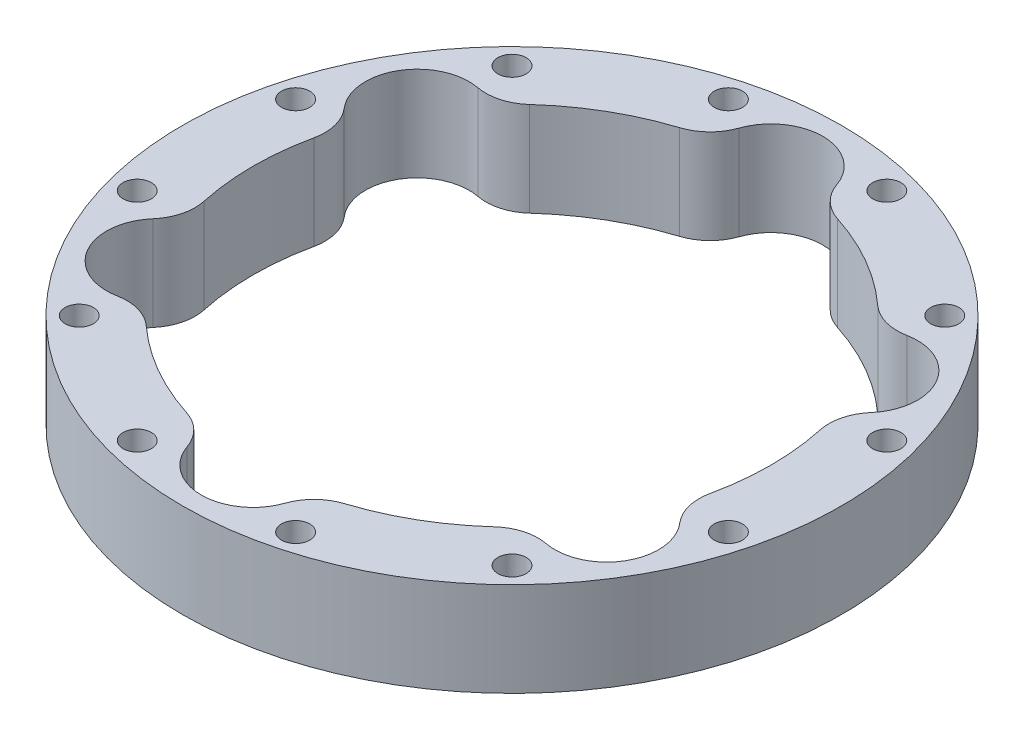
from build123d import *

# Parameters (mm, degrees)
SKETCH1_R           = 35
SKETCH1_R_2         = 1.5
BOSS_EXTRUDE1_DEPTH = 10
FILLET1_R           = 5


with BuildPart() as part:
    # Sketch1 → Boss-Extrude1 (new body)
    with BuildSketch(Plane(origin=(0, 0, 0), x_dir=(1, 0, 0), z_dir=(0, 1, 0))):
        with Locations(Location((0, 0, 0), (0, 0, 270))):
            Circle(SKETCH1_R)
        with Locations(Location((-22.980970389, -22.980970389, 0), (0, 0, 270))):
            Circle(SKETCH1_R_2, mode=Mode.SUBTRACT)
        with Locations(Location((-8.411618966, -31.392589354, 0), (0, 0, 270))):
            Circle(SKETCH1_R_2, mode=Mode.SUBTRACT)
        with Locations(Location((-31.392589354, -8.411618966, 0), (0, 0, 270))):
            Circle(SKETCH1_R_2, mode=Mode.SUBTRACT)
        with Locations(Location((8.411618966, -31.392589354, 0), (0, 0, 270))):
            Circle(SKETCH1_R_2, mode=Mode.SUBTRACT)
        with Locations(Location((22.980970389, -22.980970389, 0), (0, 0, 270))):
            Circle(SKETCH1_R_2, mode=Mode.SUBTRACT)
        with Locations(Location((31.392589354, -8.411618966, 0), (0, 0, 270))):
            Circle(SKETCH1_R_2, mode=Mode.SUBTRACT)
        with Locations(Location((-31.392589354, 8.411618966, 0), (0, 0, 270))):
            Circle(SKETCH1_R_2, mode=Mode.SUBTRACT)
        with Locations(Location((-22.980970389, 22.980970389, 0), (0, 0, 270))):
            Circle(SKETCH1_R_2, mode=Mode.SUBTRACT)
        with Locations(Location((-8.411618966, 31.392589354, 0), (0, 0, 270))):
            Circle(SKETCH1_R_2, mode=Mode.SUBTRACT)
        with BuildLine():
            ThreePointArc((26.075600084, 8.735735817), (27.141564088, 4.425550683), (27.5, 0))
            ThreePointArc((27.5, 0), (27.141564088, -4.425550683), (26.075600084, -8.735735817))
            ThreePointArc((26.075600084, -8.735735817), (28.435193064, -10.764992307), (29.315698604, -13.75))
            ThreePointArc((29.315698604, -13.75), (26.323794313, -18.644839723), (20.60316918, -18.214264183))
            ThreePointArc((20.60316918, -18.214264183), (13.75, -23.815698604), (5.472430904, -26.95))
            ThreePointArc((5.472430904, -26.95), (5.493103402, -27.224654737), (5.5, -27.5))
            ThreePointArc((5.5, -27.5), (-0.275345263, -32.993103402), (-5.472430904, -26.95))
            ThreePointArc((-5.472430904, -26.95), (-13.75, -23.815698604), (-20.60316918, -18.214264183))
            ThreePointArc((-20.60316918, -18.214264183), (-28.578838325, -16.5), (-26.075600084, -8.735735817))
            ThreePointArc((-26.075600084, -8.735735817), (-27.5, 0), (-26.075600084, 8.735735817))
            ThreePointArc((-26.075600084, 8.735735817), (-28.578838325, 16.5), (-20.60316918, 18.214264183))
            ThreePointArc((-20.60316918, 18.214264183), (-13.75, 23.815698604), (-5.472430904, 26.95))
            ThreePointArc((-5.472430904, 26.95), (-0.275345263, 32.993103402), (5.5, 27.5))
            ThreePointArc((5.5, 27.5), (5.493103402, 27.224654737), (5.472430904, 26.95))
            ThreePointArc((5.472430904, 26.95), (13.75, 23.815698604), (20.60316918, 18.214264183))
            ThreePointArc((20.60316918, 18.214264183), (26.323794313, 18.644839723), (29.315698604, 13.75))
            ThreePointArc((29.315698604, 13.75), (28.435193064, 10.764992307), (26.075600084, 8.735735817))
        make_face(mode=Mode.SUBTRACT)
        with Locations(Location((31.392589354, 8.411618966, 0), (0, 0, 270))):
            Circle(SKETCH1_R_2, mode=Mode.SUBTRACT)
        with Locations(Location((8.411618966, 31.392589354, 0), (0, 0, 270))):
            Circle(SKETCH1_R_2, mode=Mode.SUBTRACT)
        with Locations(Location((22.980970389, 22.980970389, 0), (0, 0, 270))):
            Circle(SKETCH1_R_2, mode=Mode.SUBTRACT)
    extrude(amount=BOSS_EXTRUDE1_DEPTH)

    # Fillet1
    fillet1_edges = [part.edges().sort_by_distance(p)[0] for p in [
        (-26.075600084, 5, -8.735735817),
        (-26.075600084, 5, 8.735735817),
        (-20.60316918, 5, 18.214264183),
        (-5.472430904, 5, 26.95),
        (5.472430904, 5, 26.95),
        (20.60316918, 5, 18.214264183),
        (26.075600084, 5, 8.735735817),
        (26.075600084, 5, -8.735735817),
        (20.60316918, 5, -18.214264183),
        (5.472430904, 5, -26.95),
        (-5.472430904, 5, -26.95),
        (-20.60316918, 5, -18.214264183),
    ]]
    fillet(fillet1_edges, radius=FILLET1_R)


solid = part.part
